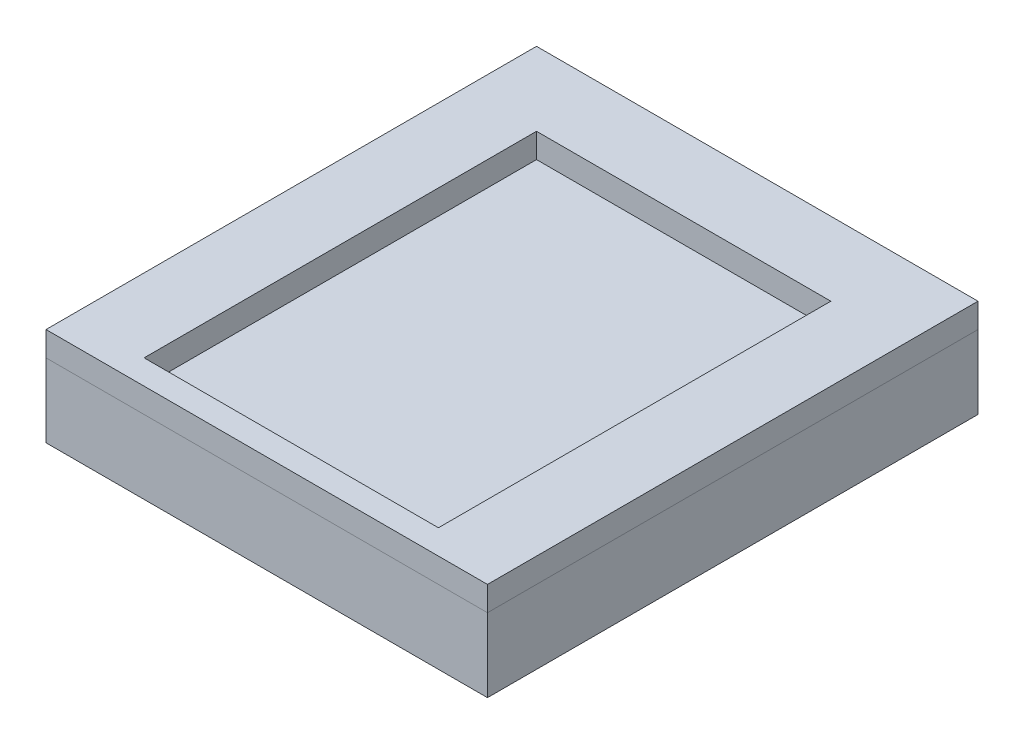
from build123d import *

# Parameters (mm, degrees)
SKETCH_1_W          = 18
SKETCH_1_H          = 20
EXTRUDE_1_DEPTH     = 3
CUT_EXTRUDE_START   = 1
SKETCH_3_W          = 16
SKETCH_3_H          = 19
CUT_EXTRUDE_1_DEPTH = 3
EXTRUDE_START       = 3
SKETCH_4_W          = 18
SKETCH_4_H          = 20
EXTRUDE_2_DEPTH     = 1
CUT_EXTRUDE_START_2 = 4
SKETCH_7_W          = 12
SKETCH_7_H          = 16
CUT_EXTRUDE_3_DEPTH = 1


with BuildPart() as part:
    # 스케치1 → 보스-돌출1 (new body)
    with BuildSketch(Plane(origin=(0, 0, 0), x_dir=(1, 0, 0), z_dir=(0, 1, 0))):
        Rectangle(SKETCH_1_W, SKETCH_1_H)
    extrude(amount=EXTRUDE_1_DEPTH)

    # 스케치3 → 컷-돌출1 (cut)
    with BuildSketch(Plane(origin=(0, 0, 0), x_dir=(1, 0, 0), z_dir=(0, 1, 0)).offset(CUT_EXTRUDE_START)):
        with Locations((0, 0.5)):
            Rectangle(SKETCH_3_W, SKETCH_3_H)
    extrude(amount=CUT_EXTRUDE_1_DEPTH, mode=Mode.SUBTRACT)


with BuildPart() as body_2:
    # 스케치4 → 보스-돌출2 (new body)
    with BuildSketch(Plane(origin=(0, 0, 0), x_dir=(1, 0, 0), z_dir=(0, 1, 0)).offset(EXTRUDE_START)):
        Rectangle(SKETCH_4_W, SKETCH_4_H)
    extrude(amount=EXTRUDE_2_DEPTH)

    # 스케치7 → 컷-돌출3 (cut)
    with BuildSketch(Plane(origin=(0, 0, 0), x_dir=(1, 0, 0), z_dir=(0, 1, 0)).offset(CUT_EXTRUDE_START_2)):
        with Locations((0, -1)):
            Rectangle(SKETCH_7_W, SKETCH_7_H)
    extrude(amount=-CUT_EXTRUDE_3_DEPTH, mode=Mode.SUBTRACT)


solid = Compound([part.part, body_2.part])
